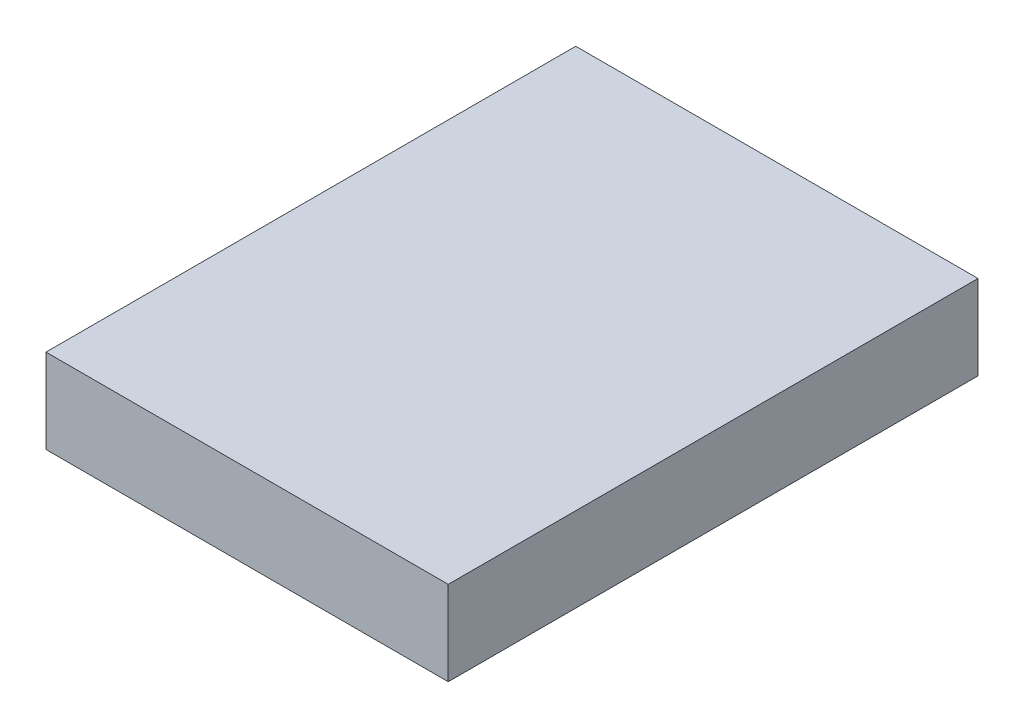
from build123d import *

# Parameters (mm, degrees)
SKETCH1_W           = 20.5
SKETCH1_H           = 27
BOSS_EXTRUDE1_DEPTH = 4.3


with BuildPart() as part:
    # Sketch1 → Boss-Extrude1 (new body)
    with BuildSketch(Plane(origin=(0, 0, 0), x_dir=(1, 0, 0), z_dir=(0, 1, 0))):
        Rectangle(SKETCH1_W, SKETCH1_H)
    extrude(amount=BOSS_EXTRUDE1_DEPTH)


solid = part.part
